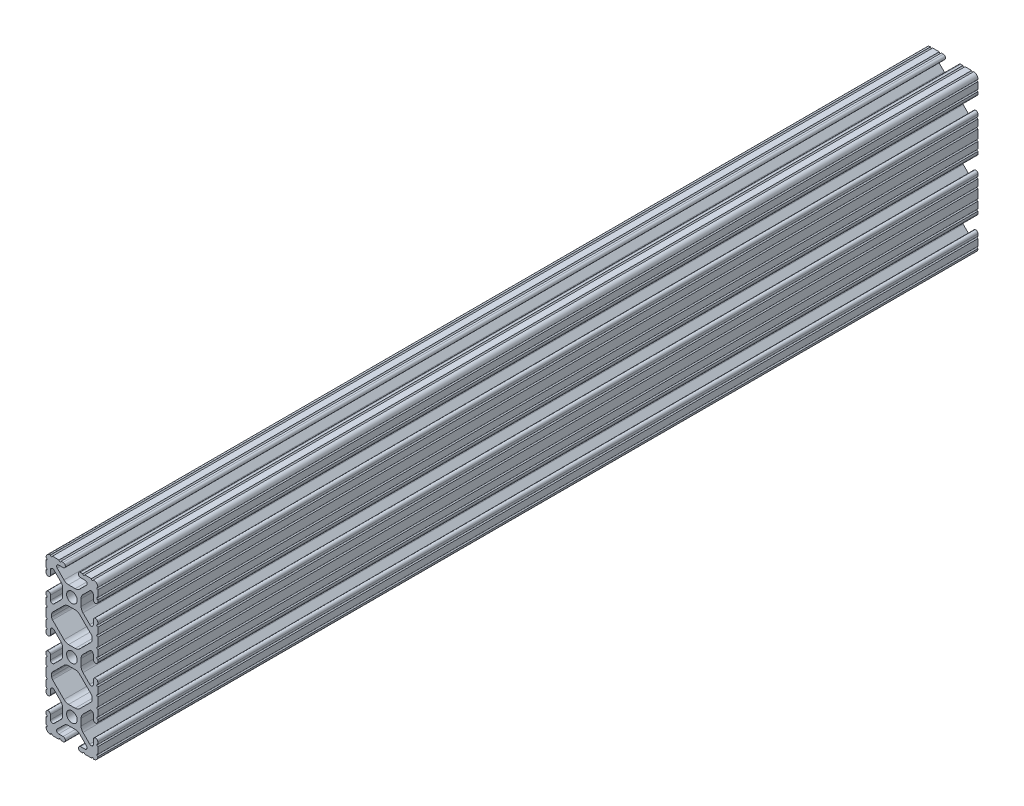
from build123d import *

# Parameters (mm, degrees)
SKETCH1_R           = 2.6035
BOSS_EXTRUDE1_DEPTH = 431.8


with BuildPart() as part:
    # Sketch1 → Boss-Extrude1 (new body)
    with BuildSketch(Plane.XY):
        with BuildLine():
            Line((-6.3246, 38.1), (-9.5504, 38.1))
            ThreePointArc((-9.5504, 38.1), (-10.0584, 37.592), (-10.5664, 38.1))
            ThreePointArc((-10.5664, 38.1), (-12.082677406, 37.482677406), (-12.7, 35.9664))
            ThreePointArc((-12.7, 35.9664), (-12.192, 35.4584), (-12.7, 34.9504))
            Line((-12.7, 34.9504), (-12.7, 31.7246))
            ThreePointArc((-12.7, 31.7246), (-12.192, 31.2166), (-12.7, 30.7086))
            Line((-12.7, 30.7086), (-12.7, 29.702307889))
            ThreePointArc((-12.7, 29.702307889), (-11.5951, 28.597407889), (-10.4902, 29.702307889))
            Line((-10.4902, 29.702307889), (-10.4902, 31.874794456))
            ThreePointArc((-10.4902, 31.874794456), (-9.863006367, 32.813456061), (-8.75577951, 32.593214945))
            Line((-8.75577951, 32.593214945), (-5.43843597, 29.275871405))
            ThreePointArc((-5.43843597, 29.275871405), (-4.750182484, 28.245827272), (-4.5085, 27.030807374))
            Line((-4.5085, 27.030807374), (-4.5085, 23.769192626))
            ThreePointArc((-4.5085, 23.769192626), (-4.750182484, 22.554172728), (-5.43843597, 21.524128595))
            Line((-5.43843597, 21.524128595), (-8.75577951, 18.206785055))
            ThreePointArc((-8.75577951, 18.206785055), (-9.863006367, 17.986543939), (-10.4902, 18.925205544))
            Line((-10.4902, 18.925205544), (-10.4902, 21.097692111))
            ThreePointArc((-10.4902, 21.097692111), (-11.5951, 22.202592111), (-12.7, 21.097692111))
            Line((-12.7, 21.097692111), (-12.7, 20.0914))
            ThreePointArc((-12.7, 20.0914), (-12.192, 19.5834), (-12.7, 19.0754))
            Line((-12.7, 19.0754), (-12.7, 15.8496))
            ThreePointArc((-12.7, 15.8496), (-12.192, 15.3416), (-12.7, 14.8336))
            Line((-12.7, 14.8336), (-12.7, 10.5664))
            ThreePointArc((-12.7, 10.5664), (-12.192, 10.0584), (-12.7, 9.5504))
            Line((-12.7, 9.5504), (-12.7, 6.3246))
            ThreePointArc((-12.7, 6.3246), (-12.192, 5.8166), (-12.7, 5.3086))
            Line((-12.7, 5.3086), (-12.7, 4.302307889))
            ThreePointArc((-12.7, 4.302307889), (-11.5951, 3.197407889), (-10.4902, 4.302307889))
            Line((-10.4902, 4.302307889), (-10.4902, 6.474794456))
            ThreePointArc((-10.4902, 6.474794456), (-9.863006367, 7.413456061), (-8.75577951, 7.193214945))
            Line((-8.75577951, 7.193214945), (-5.43843597, 3.875871405))
            ThreePointArc((-5.43843597, 3.875871405), (-4.750182484, 2.845827272), (-4.5085, 1.630807374))
            Line((-4.5085, 1.630807374), (-4.5085, -1.630807374))
            ThreePointArc((-4.5085, -1.630807374), (-4.750182484, -2.845827272), (-5.43843597, -3.875871405))
            Line((-5.43843597, -3.875871405), (-8.75577951, -7.193214945))
            ThreePointArc((-8.75577951, -7.193214945), (-9.863006367, -7.413456061), (-10.4902, -6.474794456))
            Line((-10.4902, -6.474794456), (-10.4902, -4.302307889))
            ThreePointArc((-10.4902, -4.302307889), (-11.5951, -3.197407889), (-12.7, -4.302307889))
            Line((-12.7, -4.302307889), (-12.7, -5.3086))
            ThreePointArc((-12.7, -5.3086), (-12.192, -5.8166), (-12.7, -6.3246))
            Line((-12.7, -6.3246), (-12.7, -9.5504))
            ThreePointArc((-12.7, -9.5504), (-12.192, -10.0584), (-12.7, -10.5664))
            Line((-12.7, -10.5664), (-12.7, -14.8336))
            ThreePointArc((-12.7, -14.8336), (-12.192, -15.3416), (-12.7, -15.8496))
            Line((-12.7, -15.8496), (-12.7, -19.0754))
            ThreePointArc((-12.7, -19.0754), (-12.192, -19.5834), (-12.7, -20.0914))
            Line((-12.7, -20.0914), (-12.7, -21.097692111))
            ThreePointArc((-12.7, -21.097692111), (-11.5951, -22.202592111), (-10.4902, -21.097692111))
            Line((-10.4902, -21.097692111), (-10.4902, -18.925205544))
            ThreePointArc((-10.4902, -18.925205544), (-9.863006367, -17.986543939), (-8.75577951, -18.206785055))
            Line((-8.75577951, -18.206785055), (-5.43843597, -21.524128595))
            ThreePointArc((-5.43843597, -21.524128595), (-4.750182484, -22.554172728), (-4.5085, -23.769192626))
            Line((-4.5085, -23.769192626), (-4.5085, -27.030807374))
            ThreePointArc((-4.5085, -27.030807374), (-4.750182484, -28.245827272), (-5.43843597, -29.275871405))
            Line((-5.43843597, -29.275871405), (-8.75577951, -32.593214945))
            ThreePointArc((-8.75577951, -32.593214945), (-9.863006367, -32.813456061), (-10.4902, -31.874794456))
            Line((-10.4902, -31.874794456), (-10.4902, -29.702307889))
            ThreePointArc((-10.4902, -29.702307889), (-11.5951, -28.597407889), (-12.7, -29.702307889))
            Line((-12.7, -29.702307889), (-12.7, -30.7086))
            ThreePointArc((-12.7, -30.7086), (-12.192, -31.2166), (-12.7, -31.7246))
            Line((-12.7, -31.7246), (-12.7, -34.9504))
            ThreePointArc((-12.7, -34.9504), (-12.192, -35.4584), (-12.7, -35.9664))
            ThreePointArc((-12.7, -35.9664), (-12.082677406, -37.482677406), (-10.5664, -38.1))
            ThreePointArc((-10.5664, -38.1), (-10.0584, -37.592), (-9.5504, -38.1))
            Line((-9.5504, -38.1), (-6.3246, -38.1))
            ThreePointArc((-6.3246, -38.1), (-5.8166, -37.592), (-5.3086, -38.1))
            Line((-5.3086, -38.1), (-4.302307889, -38.1))
            ThreePointArc((-4.302307889, -38.1), (-3.197407889, -36.9951), (-4.302307889, -35.8902))
            Line((-4.302307889, -35.8902), (-6.474794456, -35.8902))
            ThreePointArc((-6.474794456, -35.8902), (-7.413456061, -35.263006367), (-7.193214945, -34.15577951))
            Line((-7.193214945, -34.15577951), (-3.875871405, -30.83843597))
            ThreePointArc((-3.875871405, -30.83843597), (-2.845827272, -30.150182484), (-1.630807374, -29.9085))
            Line((-1.630807374, -29.9085), (1.630807374, -29.9085))
            ThreePointArc((1.630807374, -29.9085), (2.845827272, -30.150182484), (3.875871405, -30.83843597))
            Line((3.875871405, -30.83843597), (7.193214945, -34.15577951))
            ThreePointArc((7.193214945, -34.15577951), (7.413456061, -35.263006367), (6.474794456, -35.8902))
            Line((6.474794456, -35.8902), (4.302307889, -35.8902))
            ThreePointArc((4.302307889, -35.8902), (3.197407889, -36.9951), (4.302307889, -38.1))
            Line((4.302307889, -38.1), (5.3086, -38.1))
            ThreePointArc((5.3086, -38.1), (5.8166, -37.592), (6.3246, -38.1))
            Line((6.3246, -38.1), (9.5504, -38.1))
            ThreePointArc((9.5504, -38.1), (10.0584, -37.592), (10.5664, -38.1))
            ThreePointArc((10.5664, -38.1), (12.082677406, -37.482677406), (12.7, -35.9664))
            ThreePointArc((12.7, -35.9664), (12.192, -35.4584), (12.7, -34.9504))
            Line((12.7, -34.9504), (12.7, -31.7246))
            ThreePointArc((12.7, -31.7246), (12.192, -31.2166), (12.7, -30.7086))
            Line((12.7, -30.7086), (12.7, -29.702307918))
            ThreePointArc((12.7, -29.702307918), (11.5951, -28.597407918), (10.4902, -29.702307918))
            Line((10.4902, -29.702307918), (10.4902, -31.874794456))
            ThreePointArc((10.4902, -31.874794456), (9.863006367, -32.813456061), (8.75577951, -32.593214945))
            Line((8.75577951, -32.593214945), (5.43843597, -29.275871405))
            ThreePointArc((5.43843597, -29.275871405), (4.750182484, -28.245827272), (4.5085, -27.030807374))
            Line((4.5085, -27.030807374), (4.5085, -23.769192626))
            ThreePointArc((4.5085, -23.769192626), (4.750182484, -22.554172728), (5.43843597, -21.524128595))
            Line((5.43843597, -21.524128595), (8.75577951, -18.206785055))
            ThreePointArc((8.75577951, -18.206785055), (9.863006367, -17.986543939), (10.4902, -18.925205544))
            Line((10.4902, -18.925205544), (10.4902, -21.097692058))
            ThreePointArc((10.4902, -21.097692058), (11.5951, -22.202592058), (12.7, -21.097692058))
            Line((12.7, -21.097692058), (12.7, -20.0914))
            ThreePointArc((12.7, -20.0914), (12.192, -19.5834), (12.7, -19.0754))
            Line((12.7, -19.0754), (12.7, -15.8496))
            ThreePointArc((12.7, -15.8496), (12.192, -15.3416), (12.7, -14.8336))
            Line((12.7, -14.8336), (12.7, -10.5664))
            ThreePointArc((12.7, -10.5664), (12.192, -10.0584), (12.7, -9.5504))
            Line((12.7, -9.5504), (12.7, -6.3246))
            ThreePointArc((12.7, -6.3246), (12.192, -5.8166), (12.7, -5.3086))
            Line((12.7, -5.3086), (12.7, -4.302307889))
            ThreePointArc((12.7, -4.302307889), (11.5951, -3.197407889), (10.4902, -4.302307889))
            Line((10.4902, -4.302307889), (10.4902, -6.474794456))
            ThreePointArc((10.4902, -6.474794456), (9.863006367, -7.413456061), (8.75577951, -7.193214945))
            Line((8.75577951, -7.193214945), (5.43843597, -3.875871405))
            ThreePointArc((5.43843597, -3.875871405), (4.750182484, -2.845827272), (4.5085, -1.630807374))
            Line((4.5085, -1.630807374), (4.5085, 1.630807374))
            ThreePointArc((4.5085, 1.630807374), (4.750182484, 2.845827272), (5.43843597, 3.875871405))
            Line((5.43843597, 3.875871405), (8.75577951, 7.193214945))
            ThreePointArc((8.75577951, 7.193214945), (9.863006367, 7.413456061), (10.4902, 6.474794456))
            Line((10.4902, 6.474794456), (10.4902, 4.302307889))
            ThreePointArc((10.4902, 4.302307889), (11.5951, 3.197407889), (12.7, 4.302307889))
            Line((12.7, 4.302307889), (12.7, 5.3086))
            ThreePointArc((12.7, 5.3086), (12.192, 5.8166), (12.7, 6.3246))
            Line((12.7, 6.3246), (12.7, 9.5504))
            ThreePointArc((12.7, 9.5504), (12.192, 10.0584), (12.7, 10.5664))
            Line((12.7, 10.5664), (12.7, 14.8336))
            ThreePointArc((12.7, 14.8336), (12.192, 15.3416), (12.7, 15.8496))
            Line((12.7, 15.8496), (12.7, 19.0754))
            ThreePointArc((12.7, 19.0754), (12.192, 19.5834), (12.7, 20.0914))
            Line((12.7, 20.0914), (12.7, 21.097692082))
            ThreePointArc((12.7, 21.097692082), (11.5951, 22.202592082), (10.4902, 21.097692082))
            Line((10.4902, 21.097692082), (10.4902, 18.925205544))
            ThreePointArc((10.4902, 18.925205544), (9.863006367, 17.986543939), (8.75577951, 18.206785055))
            Line((8.75577951, 18.206785055), (5.43843597, 21.524128595))
            ThreePointArc((5.43843597, 21.524128595), (4.750182484, 22.554172728), (4.5085, 23.769192626))
            Line((4.5085, 23.769192626), (4.5085, 27.030807374))
            ThreePointArc((4.5085, 27.030807374), (4.750182484, 28.245827272), (5.43843597, 29.275871405))
            Line((5.43843597, 29.275871405), (8.75577951, 32.593214945))
            ThreePointArc((8.75577951, 32.593214945), (9.863006367, 32.813456061), (10.4902, 31.874794456))
            Line((10.4902, 31.874794456), (10.4902, 29.702307889))
            ThreePointArc((10.4902, 29.702307889), (11.5951, 28.597407889), (12.7, 29.702307889))
            Line((12.7, 29.702307889), (12.7, 30.7086))
            ThreePointArc((12.7, 30.7086), (12.192, 31.2166), (12.7, 31.7246))
            Line((12.7, 31.7246), (12.7, 34.9504))
            ThreePointArc((12.7, 34.9504), (12.192, 35.4584), (12.7, 35.9664))
            ThreePointArc((12.7, 35.9664), (12.082677406, 37.482677406), (10.5664, 38.1))
            ThreePointArc((10.5664, 38.1), (10.0584, 37.592), (9.5504, 38.1))
            Line((9.5504, 38.1), (6.3246, 38.1))
            ThreePointArc((6.3246, 38.1), (5.8166, 37.592), (5.3086, 38.1))
            Line((5.3086, 38.1), (4.302307889, 38.1))
            ThreePointArc((4.302307889, 38.1), (3.197407889, 36.9951), (4.302307889, 35.8902))
            Line((4.302307889, 35.8902), (6.474794456, 35.8902))
            ThreePointArc((6.474794456, 35.8902), (7.413456061, 35.263006367), (7.193214945, 34.15577951))
            Line((7.193214945, 34.15577951), (3.875871405, 30.83843597))
            ThreePointArc((3.875871405, 30.83843597), (2.845827272, 30.150182484), (1.630807374, 29.9085))
            Line((1.630807374, 29.9085), (-1.630807374, 29.9085))
            ThreePointArc((-1.630807374, 29.9085), (-2.845827272, 30.150182484), (-3.875871405, 30.83843597))
            Line((-3.875871405, 30.83843597), (-7.193214945, 34.15577951))
            ThreePointArc((-7.193214945, 34.15577951), (-7.413456061, 35.263006367), (-6.474794456, 35.8902))
            Line((-6.474794456, 35.8902), (-4.302307889, 35.8902))
            ThreePointArc((-4.302307889, 35.8902), (-3.197407889, 36.9951), (-4.302307889, 38.1))
            Line((-4.302307889, 38.1), (-5.3086, 38.1))
            ThreePointArc((-5.3086, 38.1), (-5.8166, 37.592), (-6.3246, 38.1))
        make_face()
        with Locations(Location((0, 25.4, 0), (0, 0, 180))):
            Circle(SKETCH1_R, mode=Mode.SUBTRACT)
        with Locations(Location((0, -25.4, 0), (0, 0, 180))):
            Circle(SKETCH1_R, mode=Mode.SUBTRACT)
        with Locations(Location((0, 0, 0), (0, 0, 180))):
            Circle(SKETCH1_R, mode=Mode.SUBTRACT)
        with BuildLine():
            Line((-9.9314, 12.146268083), (-9.9314, 13.253731917))
            ThreePointArc((-9.9314, 13.253731917), (-9.811525488, 13.856381786), (-9.470151759, 14.367283676))
            Line((-9.470151759, 14.367283676), (-3.875871405, 19.96156403))
            ThreePointArc((-3.875871405, 19.96156403), (-2.845827272, 20.649817516), (-1.630807374, 20.8915))
            Line((-1.630807374, 20.8915), (1.630807374, 20.8915))
            ThreePointArc((1.630807374, 20.8915), (2.845827272, 20.649817516), (3.875871405, 19.96156403))
            Line((3.875871405, 19.96156403), (9.470151759, 14.367283676))
            ThreePointArc((9.470151759, 14.367283676), (9.811525488, 13.856381786), (9.9314, 13.253731917))
            Line((9.9314, 13.253731917), (9.9314, 12.146268083))
            ThreePointArc((9.9314, 12.146268083), (9.811525488, 11.543618214), (9.470151759, 11.032716324))
            Line((9.470151759, 11.032716324), (3.875871405, 5.43843597))
            ThreePointArc((3.875871405, 5.43843597), (2.845827272, 4.750182484), (1.630807374, 4.5085))
            Line((1.630807374, 4.5085), (-1.630807374, 4.5085))
            ThreePointArc((-1.630807374, 4.5085), (-2.845827272, 4.750182484), (-3.875871405, 5.43843597))
            Line((-3.875871405, 5.43843597), (-9.470151759, 11.032716324))
            ThreePointArc((-9.470151759, 11.032716324), (-9.811525488, 11.543618214), (-9.9314, 12.146268083))
        make_face(mode=Mode.SUBTRACT)
        with BuildLine():
            Line((-9.9314, -13.253731917), (-9.9314, -12.146268083))
            ThreePointArc((-9.9314, -12.146268083), (-9.811525488, -11.543618214), (-9.470151759, -11.032716324))
            Line((-9.470151759, -11.032716324), (-3.875871405, -5.43843597))
            ThreePointArc((-3.875871405, -5.43843597), (-2.845827272, -4.750182484), (-1.630807374, -4.5085))
            Line((-1.630807374, -4.5085), (1.630807374, -4.5085))
            ThreePointArc((1.630807374, -4.5085), (2.845827272, -4.750182484), (3.875871405, -5.43843597))
            Line((3.875871405, -5.43843597), (9.470151759, -11.032716324))
            ThreePointArc((9.470151759, -11.032716324), (9.811525488, -11.543618214), (9.9314, -12.146268083))
            Line((9.9314, -12.146268083), (9.9314, -13.253731917))
            ThreePointArc((9.9314, -13.253731917), (9.811525488, -13.856381786), (9.470151759, -14.367283676))
            Line((9.470151759, -14.367283676), (3.875871405, -19.96156403))
            ThreePointArc((3.875871405, -19.96156403), (2.845827272, -20.649817516), (1.630807374, -20.8915))
            Line((1.630807374, -20.8915), (-1.630807374, -20.8915))
            ThreePointArc((-1.630807374, -20.8915), (-2.845827272, -20.649817516), (-3.875871405, -19.96156403))
            Line((-3.875871405, -19.96156403), (-9.470151759, -14.367283676))
            ThreePointArc((-9.470151759, -14.367283676), (-9.811525488, -13.856381786), (-9.9314, -13.253731917))
        make_face(mode=Mode.SUBTRACT)
    extrude(amount=-BOSS_EXTRUDE1_DEPTH)


solid = part.part
